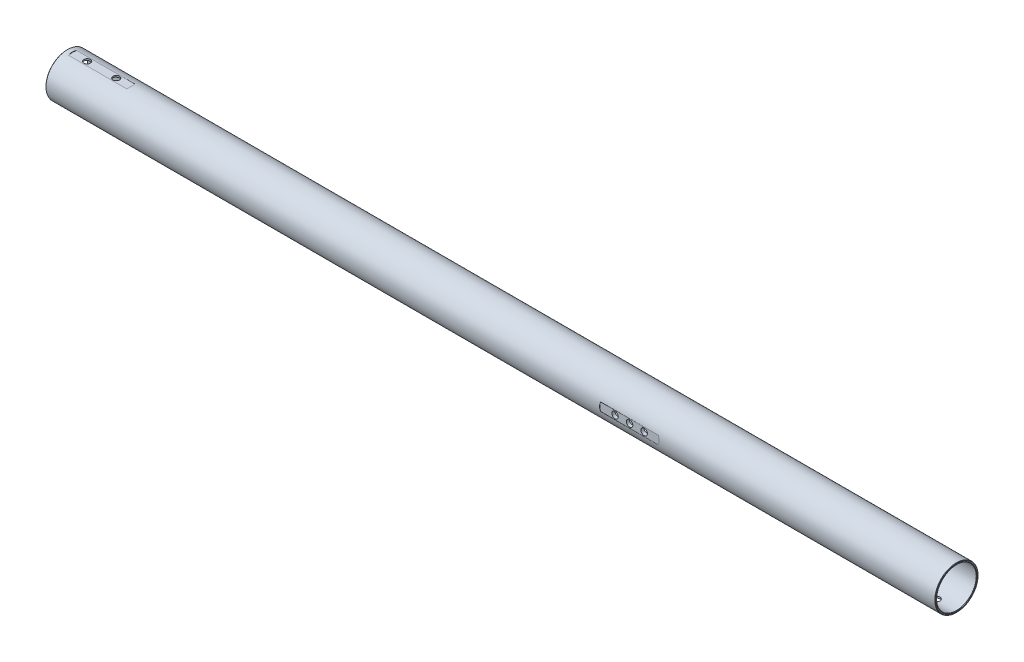
from build123d import *

# Parameters (mm, degrees)
SKETCH1_R                     = 25
SKETCH1_R_2                   = 23
EXTRUDE_THIN1_DEPTH           = 515
EXTRUDE_THIN2_START           = 210
SKETCH1_3_R                   = 25
SKETCH1_3_R_2                 = 21
EXTRUDE_THIN2_DEPTH           = 90
CUT_EXTRUDE1_START            = 24.54
CUT_EXTRUDE1_DEPTH            = 492.672165684
CUT_EXTRUDE2_START            = -24.54
CUT_EXTRUDE2_DEPTH            = 492.672165793
CUT_EXTRUDE3_START            = -24.54
CUT_EXTRUDE3_DEPTH            = 492.672165793
CUT_EXTRUDE4_START            = 24.54
CUT_EXTRUDE4_DEPTH            = 492.672165793
M_0_295_DIAMETER_HOLE3_REACH  = 519.981
M_0_295_DIAMETER_HOLE3_BORE_R = 3.7465
M_0_295_DIAMETER_HOLE4_REACH  = 519.981
M_0_295_DIAMETER_HOLE4_BORE_R = 3.7465
M_0_295_DIAMETER_HOLE5_REACH  = 519.981
M_0_295_DIAMETER_HOLE5_BORE_R = 3.7465
M_0_295_DIAMETER_HOLE6_REACH  = 519.981
M_0_295_DIAMETER_HOLE6_BORE_R = 3.7465
CHAMFER1_SIZE                 = 0.5


with BuildPart() as part:
    # Sketch1 → Extrude-Thin1 (new, symmetric)
    with BuildSketch(Plane(origin=(0, 0, 0), x_dir=(0, 0, -1), z_dir=(1, 0, 0))):
        Circle(SKETCH1_R)
        Circle(SKETCH1_R_2, mode=Mode.SUBTRACT)
    extrude(amount=EXTRUDE_THIN1_DEPTH, both=True)

    # Sketch1<3> → Extrude-Thin2 (add)
    with BuildSketch(Plane(origin=(0, 0, 0), x_dir=(0, 0, -1), z_dir=(1, 0, 0)).offset(EXTRUDE_THIN2_START)):
        Circle(SKETCH1_3_R)
        Circle(SKETCH1_3_R_2, mode=Mode.SUBTRACT)
    extrude(amount=-EXTRUDE_THIN2_DEPTH)

    # Sketch3 → Cut-Extrude1 (cut, through all)
    with BuildSketch(Plane(origin=(0, 0, 0), x_dir=(1, 0, 0), z_dir=(0, 1, 0)).offset(CUT_EXTRUDE1_START)):
        with BuildLine():
            Line((-491.7775, -17.4725), (-458.1225, -17.4725))
            ThreePointArc((-458.1225, -17.4725), (-440.65, 0), (-458.1225, 17.4725))
            Line((-458.1225, 17.4725), (-491.7775, 17.4725))
            ThreePointArc((-491.7775, 17.4725), (-509.25, 0), (-491.7775, -17.4725))
        make_face()
    extrude(amount=CUT_EXTRUDE1_DEPTH, mode=Mode.SUBTRACT)

    # Sketch8 → Cut-Extrude2 (cut, through all)
    with BuildSketch(Plane.XY.offset(CUT_EXTRUDE2_START)):
        with BuildLine():
            Line((-272.5275, -17.4725), (-238.8725, -17.4725))
            ThreePointArc((-238.8725, -17.4725), (-221.4, 0), (-238.8725, 17.4725))
            Line((-238.8725, 17.4725), (-272.5275, 17.4725))
            ThreePointArc((-272.5275, 17.4725), (-290, 0), (-272.5275, -17.4725))
        make_face()
    extrude(amount=-CUT_EXTRUDE2_DEPTH, mode=Mode.SUBTRACT)

    # Sketch3<3> → Cut-Extrude3 (cut, through all)
    with BuildSketch(Plane(origin=(0, 0, 0), x_dir=(1, 0, 0), z_dir=(0, 1, 0)).offset(CUT_EXTRUDE3_START)):
        with BuildLine():
            ThreePointArc((458.1225, -17.4725), (440.65, 0), (458.1225, 17.4725))
            Line((458.1225, 17.4725), (491.7775, 17.4725))
            ThreePointArc((491.7775, 17.4725), (509.25, 0), (491.7775, -17.4725))
            Line((491.7775, -17.4725), (458.1225, -17.4725))
        make_face()
    extrude(amount=-CUT_EXTRUDE3_DEPTH, mode=Mode.SUBTRACT)

    # Sketch8<4> → Cut-Extrude4 (cut, through all)
    with BuildSketch(Plane.XY.offset(CUT_EXTRUDE4_START)):
        with BuildLine():
            Line((143.8725, -17.4725), (177.5275, -17.4725))
            ThreePointArc((177.5275, -17.4725), (195, 0), (177.5275, 17.4725))
            Line((177.5275, 17.4725), (143.8725, 17.4725))
            ThreePointArc((143.8725, 17.4725), (126.4, 0), (143.8725, -17.4725))
        make_face()
    extrude(amount=CUT_EXTRUDE4_DEPTH, mode=Mode.SUBTRACT)

    # M (0.295) Diameter Hole3 bore → M (0.295) Diameter Hole3 (cut, up to next)
    with BuildSketch(Plane(origin=(0, 24.54, 0), x_dir=(1, 0, 0), z_dir=(0, 1, 0)), mode=Mode.PRIVATE) as m_0_295_diameter_hole3_sk1:
        with Locations((-491.7775, 0)):
            Circle(M_0_295_DIAMETER_HOLE3_BORE_R)
    m_0_295_diameter_hole3_tool1 = extrude(m_0_295_diameter_hole3_sk1.sketch, amount=-M_0_295_DIAMETER_HOLE3_REACH, mode=Mode.PRIVATE) & part.part
    # M (0.295) Diameter Hole3 bore → M (0.295) Diameter Hole3 (cut, up to next)
    with BuildSketch(Plane(origin=(0, 24.54, 0), x_dir=(1, 0, 0), z_dir=(0, 1, 0)), mode=Mode.PRIVATE) as m_0_295_diameter_hole3_sk2:
        with Locations((-458.1225, 0)):
            Circle(M_0_295_DIAMETER_HOLE3_BORE_R)
    m_0_295_diameter_hole3_tool2 = extrude(m_0_295_diameter_hole3_sk2.sketch, amount=-M_0_295_DIAMETER_HOLE3_REACH, mode=Mode.PRIVATE) & part.part
    add(m_0_295_diameter_hole3_tool1.solids().sort_by_distance((-491.7775, 24.54, 0))[0], mode=Mode.SUBTRACT)
    add(m_0_295_diameter_hole3_tool2.solids().sort_by_distance((-458.1225, 24.54, 0))[0], mode=Mode.SUBTRACT)

    # M (0.295) Diameter Hole4 bore → M (0.295) Diameter Hole4 (cut, up to next)
    with BuildSketch(Plane(origin=(0, 0, -24.54), x_dir=(-1, 0, 0), z_dir=(0, 0, -1)), mode=Mode.PRIVATE) as m_0_295_diameter_hole4_sk1:
        with Locations((238.8725, 0)):
            Circle(M_0_295_DIAMETER_HOLE4_BORE_R)
    m_0_295_diameter_hole4_tool1 = extrude(m_0_295_diameter_hole4_sk1.sketch, amount=-M_0_295_DIAMETER_HOLE4_REACH, mode=Mode.PRIVATE) & part.part
    # M (0.295) Diameter Hole4 bore → M (0.295) Diameter Hole4 (cut, up to next)
    with BuildSketch(Plane(origin=(0, 0, -24.54), x_dir=(-1, 0, 0), z_dir=(0, 0, -1)), mode=Mode.PRIVATE) as m_0_295_diameter_hole4_sk2:
        with Locations((272.5275, 0)):
            Circle(M_0_295_DIAMETER_HOLE4_BORE_R)
    m_0_295_diameter_hole4_tool2 = extrude(m_0_295_diameter_hole4_sk2.sketch, amount=-M_0_295_DIAMETER_HOLE4_REACH, mode=Mode.PRIVATE) & part.part
    add(m_0_295_diameter_hole4_tool1.solids().sort_by_distance((-238.8725, 0, -24.54))[0], mode=Mode.SUBTRACT)
    add(m_0_295_diameter_hole4_tool2.solids().sort_by_distance((-272.5275, 0, -24.54))[0], mode=Mode.SUBTRACT)

    # M (0.295) Diameter Hole5 bore → M (0.295) Diameter Hole5 (cut, up to next)
    with BuildSketch(Plane.XY.offset(24.54), mode=Mode.PRIVATE) as m_0_295_diameter_hole5_sk1:
        with Locations((143.8725, 0)):
            Circle(M_0_295_DIAMETER_HOLE5_BORE_R)
    m_0_295_diameter_hole5_tool1 = extrude(m_0_295_diameter_hole5_sk1.sketch, amount=-M_0_295_DIAMETER_HOLE5_REACH, mode=Mode.PRIVATE) & part.part
    # M (0.295) Diameter Hole5 bore → M (0.295) Diameter Hole5 (cut, up to next)
    with BuildSketch(Plane.XY.offset(24.54), mode=Mode.PRIVATE) as m_0_295_diameter_hole5_sk2:
        with Locations((160.7, 0)):
            Circle(M_0_295_DIAMETER_HOLE5_BORE_R)
    m_0_295_diameter_hole5_tool2 = extrude(m_0_295_diameter_hole5_sk2.sketch, amount=-M_0_295_DIAMETER_HOLE5_REACH, mode=Mode.PRIVATE) & part.part
    # M (0.295) Diameter Hole5 bore → M (0.295) Diameter Hole5 (cut, up to next)
    with BuildSketch(Plane.XY.offset(24.54), mode=Mode.PRIVATE) as m_0_295_diameter_hole5_sk3:
        with Locations((177.5275, 0)):
            Circle(M_0_295_DIAMETER_HOLE5_BORE_R)
    m_0_295_diameter_hole5_tool3 = extrude(m_0_295_diameter_hole5_sk3.sketch, amount=-M_0_295_DIAMETER_HOLE5_REACH, mode=Mode.PRIVATE) & part.part
    add(m_0_295_diameter_hole5_tool1.solids().sort_by_distance((143.8725, 0, 24.54))[0], mode=Mode.SUBTRACT)
    add(m_0_295_diameter_hole5_tool2.solids().sort_by_distance((160.7, 0, 24.54))[0], mode=Mode.SUBTRACT)
    add(m_0_295_diameter_hole5_tool3.solids().sort_by_distance((177.5275, 0, 24.54))[0], mode=Mode.SUBTRACT)

    # M (0.295) Diameter Hole6 bore → M (0.295) Diameter Hole6 (cut, up to next)
    with BuildSketch(Plane(origin=(0, -24.54, 0), x_dir=(-1, 0, 0), z_dir=(0, -1, 0)), mode=Mode.PRIVATE) as m_0_295_diameter_hole6_sk1:
        with Locations((-491.7775, 0)):
            Circle(M_0_295_DIAMETER_HOLE6_BORE_R)
    m_0_295_diameter_hole6_tool1 = extrude(m_0_295_diameter_hole6_sk1.sketch, amount=-M_0_295_DIAMETER_HOLE6_REACH, mode=Mode.PRIVATE) & part.part
    # M (0.295) Diameter Hole6 bore → M (0.295) Diameter Hole6 (cut, up to next)
    with BuildSketch(Plane(origin=(0, -24.54, 0), x_dir=(-1, 0, 0), z_dir=(0, -1, 0)), mode=Mode.PRIVATE) as m_0_295_diameter_hole6_sk2:
        with Locations((-458.1225, 0)):
            Circle(M_0_295_DIAMETER_HOLE6_BORE_R)
    m_0_295_diameter_hole6_tool2 = extrude(m_0_295_diameter_hole6_sk2.sketch, amount=-M_0_295_DIAMETER_HOLE6_REACH, mode=Mode.PRIVATE) & part.part
    add(m_0_295_diameter_hole6_tool1.solids().sort_by_distance((491.7775, -24.54, 0))[0], mode=Mode.SUBTRACT)
    add(m_0_295_diameter_hole6_tool2.solids().sort_by_distance((458.1225, -24.54, 0))[0], mode=Mode.SUBTRACT)

    # Chamfer1
    chamfer1_edges = [part.edges().sort_by_distance(p)[0] for p in [
        (-515, 0, 25),
        (-515, 0, 23),
        (515, 0, 25),
        (515, 0, 23),
    ]]
    chamfer(chamfer1_edges, length=CHAMFER1_SIZE)


solid = part.part
